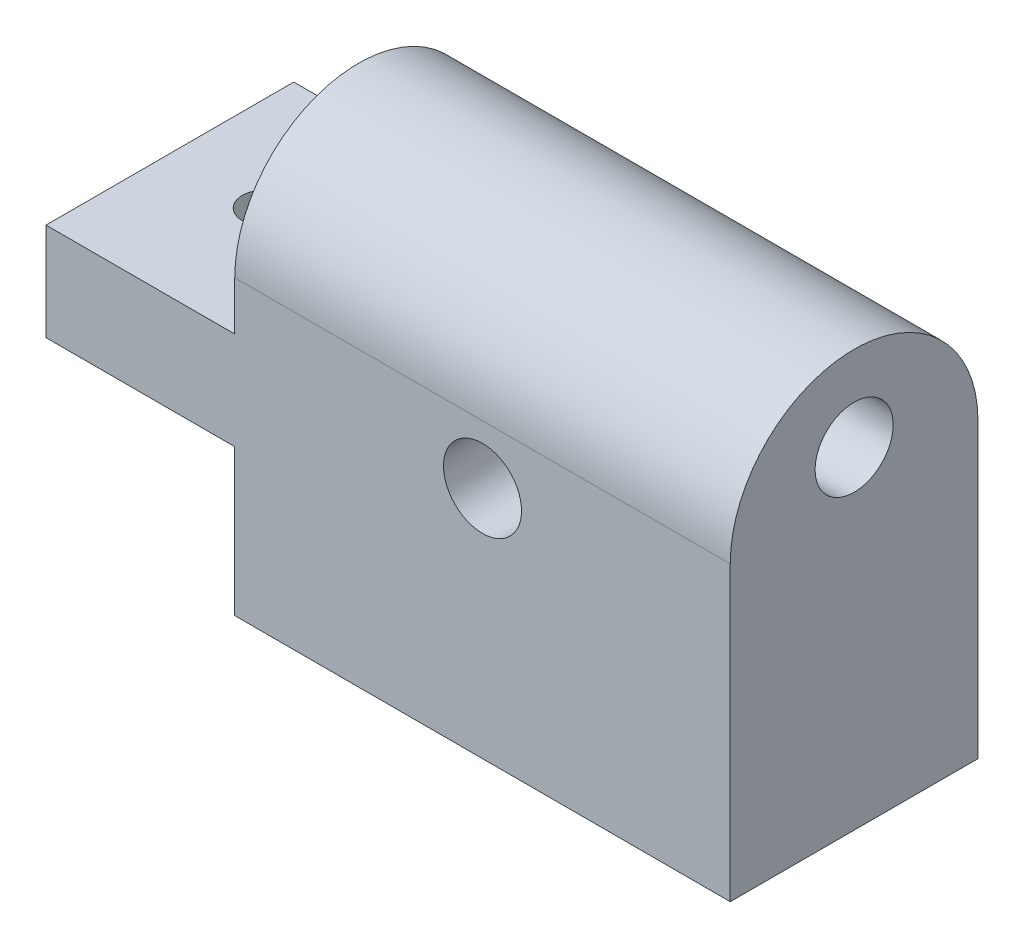
from build123d import *

# Parameters (mm, degrees)
SKETCH1_W            = 50.8
SKETCH1_H            = 30
SKETCH1_R            = 4
BOSS_EXTRUDE1_DEPTH  = 25.4
SKETCH2_R            = 4
BOSS_EXTRUDE3_DEPTH  = 50.8
SKETCH4_W            = 25.4
SKETCH4_H            = 10
BOSS_EXTRUDE4_DEPTH  = 19.3499994
M4_CLEARANCE_HOLE1_D = 4.5


with BuildPart() as part:
    # Sketch1 → Boss-Extrude1 (new body)
    with BuildSketch(Plane.XY):
        with Locations((0, -9)):
            Rectangle(SKETCH1_W, SKETCH1_H)
        Circle(SKETCH1_R, mode=Mode.SUBTRACT)
    extrude(amount=BOSS_EXTRUDE1_DEPTH)

    # Sketch2 → Boss-Extrude3 (add, through all)
    with BuildSketch(Plane(origin=(25.4, 0, 0), x_dir=(0, 0, -1), z_dir=(1, 0, 0))):
        with BuildLine():
            Line((-25.4, 6), (-25.4, 5))
            Line((-25.4, 5), (0, 5))
            Line((0, 5), (0, 6))
            ThreePointArc((0, 6), (-12.7, 18.7), (-25.4, 6))
        make_face()
        with Locations(Location((-12.7, 10, 0), (0, 0, 90))):
            Circle(SKETCH2_R, mode=Mode.SUBTRACT)
    extrude(amount=-BOSS_EXTRUDE3_DEPTH)

    # Sketch4 → Boss-Extrude4 (add)
    with BuildSketch(Plane.ZY.offset(25.4)):
        with Locations((12.7, -4)):
            Rectangle(SKETCH4_W, SKETCH4_H)
    extrude(amount=BOSS_EXTRUDE4_DEPTH)

    # M4 Clearance Hole1 (through all)
    with Locations(Plane(origin=(0, -9, 0), x_dir=(-1, 0, 0), z_dir=(0, -1, 0))):
        with Locations((35.0749997, -12.7)):
            Hole(M4_CLEARANCE_HOLE1_D / 2)


solid = part.part
